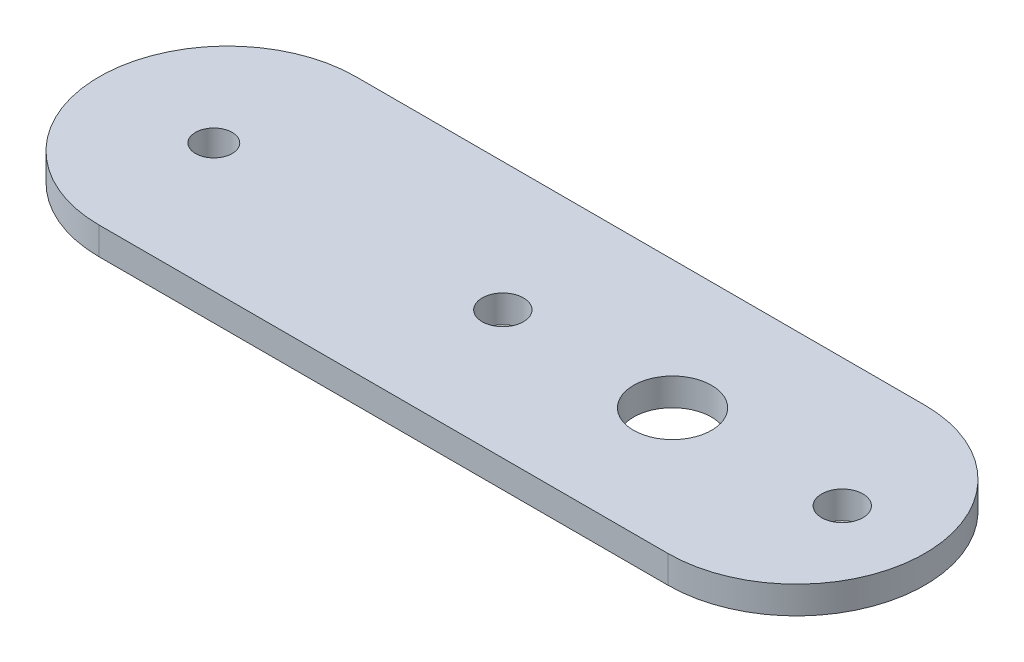
from build123d import *

# Parameters (mm, degrees)
SKETCH_1_W          = 90
SKETCH_1_H          = 28
SKETCH_1_R          = 4.25
SKETCH_1_R_2        = 2
EXTRUDE_1_DEPTH     = 3
CUT_EXTRUDE_1_REACH = 49.223
SKETCH_3_R          = 2.25
FILLET_1_RADIUS     = 14
FILLET_1_LENGTH     = 3
FILLET_2_RADIUS     = 14
FILLET_2_LENGTH     = 3


with BuildPart() as part:
    # 草图1 → 凸台-拉伸1 (new body)
    with BuildSketch(Plane(origin=(0, 0, 0), x_dir=(1, 0, 0), z_dir=(0, 1, 0))):
        Rectangle(SKETCH_1_W, SKETCH_1_H)
        with Locations(Location((17.5, 0, 0), (0, 0, 270))):
            Circle(SKETCH_1_R, mode=Mode.SUBTRACT)
        with Locations(Location((-32.5, 0, 0), (0, 0, 270))):
            Circle(SKETCH_1_R_2, mode=Mode.SUBTRACT)
    extrude(amount=EXTRUDE_1_DEPTH)

    # 草图3 → 切除-拉伸1 (cut, up to next)
    with BuildSketch(Plane(origin=(0, 3, 0), x_dir=(1, 0, 0), z_dir=(0, 1, 0)), mode=Mode.PRIVATE) as cut_extrude_1_sk1:
        with Locations(Location((36, 0, 0), (0, 0, 270))):
            Circle(SKETCH_3_R)
    cut_extrude_1_tool1 = extrude(cut_extrude_1_sk1.sketch, amount=-CUT_EXTRUDE_1_REACH, mode=Mode.PRIVATE) & part.part
    # 草图3 → 切除-拉伸1 (cut, up to next)
    with BuildSketch(Plane(origin=(0, 3, 0), x_dir=(1, 0, 0), z_dir=(0, 1, 0)), mode=Mode.PRIVATE) as cut_extrude_1_sk2:
        with Locations(Location((-1, 0, 0), (0, 0, 270))):
            Circle(SKETCH_3_R)
    cut_extrude_1_tool2 = extrude(cut_extrude_1_sk2.sketch, amount=-CUT_EXTRUDE_1_REACH, mode=Mode.PRIVATE) & part.part
    add(cut_extrude_1_tool1.solids().sort_by_distance((36, 3, 0))[0], mode=Mode.SUBTRACT)
    add(cut_extrude_1_tool2.solids().sort_by_distance((-1, 3, 0))[0], mode=Mode.SUBTRACT)

    # 圆角1: full round fillet: the end face becomes a half cylinder, R = half its width
    fillet_1_face = Plane((-45, 1.5, 0), x_dir=(0, 1, 0), z_dir=(-1, 0, 0))  # on the end face: x along it, z out of the body
    fillet_1_slab = fillet_1_face.offset(-FILLET_1_RADIUS / 2) * Box(FILLET_1_LENGTH, 2 * FILLET_1_RADIUS, FILLET_1_RADIUS, mode=Mode.PRIVATE)  # the body's end, R deep
    fillet_1_round = Plane((-31, 1.5, 0), x_dir=(-1, 0, 0), z_dir=(0, 1, 0)) * Cylinder(FILLET_1_RADIUS, FILLET_1_LENGTH, mode=Mode.PRIVATE)  # its axis R under the face
    add(fillet_1_slab - fillet_1_round, mode=Mode.SUBTRACT)

    # 圆角2: full round fillet: the end face becomes a half cylinder, R = half its width
    fillet_2_face = Plane((45, 1.5, 0), x_dir=(0, -1, 0), z_dir=(1, 0, 0))  # on the end face: x along it, z out of the body
    fillet_2_slab = fillet_2_face.offset(-FILLET_2_RADIUS / 2) * Box(FILLET_2_LENGTH, 2 * FILLET_2_RADIUS, FILLET_2_RADIUS, mode=Mode.PRIVATE)  # the body's end, R deep
    fillet_2_round = Plane((31, 1.5, 0), x_dir=(1, 0, 0), z_dir=(0, -1, 0)) * Cylinder(FILLET_2_RADIUS, FILLET_2_LENGTH, mode=Mode.PRIVATE)  # its axis R under the face
    add(fillet_2_slab - fillet_2_round, mode=Mode.SUBTRACT)


solid = part.part
